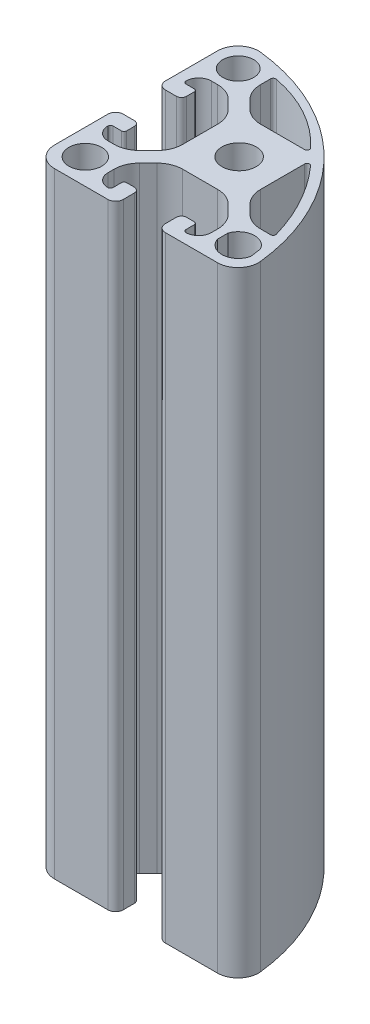
from build123d import *

# Parameters (mm, degrees)
CROQUIS1_R              = 3.35
SALIENTE_EXTRUIR1_DEPTH = 120
SALIENTE_EXTRUIR2_START = -120
SALIENTE_EXTRUIR2_DEPTH = 120


with BuildPart() as part:
    # Croquis1 → Saliente-Extruir1 (new body)
    with BuildSketch(Plane(origin=(0, 0, 0), x_dir=(1, 0, 0), z_dir=(0, 1, 0))):
        with BuildLine():
            Line((4.099999986, -16.349999949), (4.099999986, -18.499999949))
            ThreePointArc((4.099999986, -18.499999949), (4.539339815, -19.560660121), (5.599999987, -19.999999949))
            Line((5.599999987, -19.999999949), (15.777087623, -19.999999949))
            ThreePointArc((15.777087623, -19.999999949), (18.758511608, -18.66666665), (19.752319619, -15.555555546))
            ThreePointArc((19.752319619, -15.555555546), (8.284271243, 8.284271252), (-15.555555578, 19.752319582))
            ThreePointArc((-15.555555578, 19.752319582), (-18.666666685, 18.758511591), (-20.000000016, 15.777087623))
            Line((-20.000000016, 15.777087623), (-20.000000016, 5.599999985))
            ThreePointArc((-20.000000016, 5.599999985), (-19.560660185, 4.539339815), (-18.500000013, 4.099999988))
            Line((-18.500000013, 4.099999988), (-16.350000012, 4.099999988))
            ThreePointArc((-16.350000012, 4.099999988), (-15.642893231, 4.392893207), (-15.350000012, 5.099999988))
            Line((-15.350000012, 5.099999988), (-15.350000012, 6.599999984))
            ThreePointArc((-15.350000012, 6.599999984), (-15.49644662, 6.953553378), (-15.850000012, 7.099999989))
            Line((-15.850000012, 7.099999989), (-17.500000009, 7.099999989))
            ThreePointArc((-17.500000009, 7.099999989), (-17.853553401, 7.246446596), (-18.000000013, 7.599999985))
            ThreePointArc((-18.000000013, 7.599999985), (-17.267766972, 9.36776695), (-15.500000013, 10.100000003))
            Line((-15.500000013, 10.100000003), (-14.292388135, 10.100000003))
            ThreePointArc((-14.292388135, 10.100000003), (-12.378970991, 9.719397659), (-10.756854262, 8.635533909))
            Line((-10.756854262, 8.635533909), (-9.064466108, 6.943145756))
            ThreePointArc((-9.064466108, 6.943145756), (-7.980602349, 5.32102901), (-7.60000001, 3.407611846))
            Line((-7.60000001, 3.407611846), (-7.60000001, -3.407611843))
            ThreePointArc((-7.60000001, -3.407611843), (-7.980602347, -5.321029004), (-9.064466104, -6.943145748))
            Line((-9.064466104, -6.943145748), (-10.756854257, -8.635533901))
            ThreePointArc((-10.756854257, -8.635533901), (-12.378971003, -9.719397661), (-14.292388167, -10.099999999))
            Line((-14.292388167, -10.099999999), (-15.499999985, -10.099999999))
            ThreePointArc((-15.499999985, -10.099999999), (-17.267766956, -9.367766956), (-18.000000007, -7.599999987))
            ThreePointArc((-18.000000007, -7.599999987), (-17.853553397, -7.246446598), (-17.500000007, -7.099999989))
            Line((-17.500000007, -7.099999989), (-15.850000011, -7.099999989))
            ThreePointArc((-15.850000011, -7.099999989), (-15.496446618, -6.953553381), (-15.350000008, -6.599999989))
            Line((-15.350000008, -6.599999989), (-15.350000008, -5.099999989))
            ThreePointArc((-15.350000008, -5.099999989), (-15.642893227, -4.392893209), (-16.350000008, -4.09999999))
            Line((-16.350000008, -4.09999999), (-18.500000008, -4.09999999))
            ThreePointArc((-18.500000008, -4.09999999), (-19.56066018, -4.539339819), (-20.000000008, -5.599999991))
            Line((-20.000000008, -5.599999991), (-20.000000008, -15.999999939))
            ThreePointArc((-20.000000008, -15.999999939), (-18.828427101, -18.828427077), (-15.999999951, -19.999999954))
            Line((-15.999999951, -19.999999954), (-5.599999986, -19.999999954))
            ThreePointArc((-5.599999986, -19.999999954), (-4.539339818, -19.560660123), (-4.099999992, -18.499999954))
            Line((-4.099999992, -18.499999954), (-4.099999992, -16.349999953))
            ThreePointArc((-4.099999992, -16.349999953), (-4.392893211, -15.642893171), (-5.099999992, -15.349999953))
            Line((-5.099999992, -15.349999953), (-6.599999988, -15.349999953))
            ThreePointArc((-6.599999988, -15.349999953), (-6.953553382, -15.49644656), (-7.099999993, -15.849999953))
            Line((-7.099999993, -15.849999953), (-7.099999993, -17.499999952))
            ThreePointArc((-7.099999993, -17.499999952), (-7.2464466, -17.853553342), (-7.599999989, -17.999999954))
            ThreePointArc((-7.599999989, -17.999999954), (-9.367766954, -17.267766913), (-10.100000007, -15.499999954))
            Line((-10.100000007, -15.499999954), (-10.100000007, -14.292388076))
            ThreePointArc((-10.100000007, -14.292388076), (-9.719397663, -12.378970931), (-8.635533913, -10.756854202))
            Line((-8.635533913, -10.756854202), (-6.94314576, -9.064466049))
            ThreePointArc((-6.94314576, -9.064466049), (-5.321029014, -7.980602289), (-3.40761185, -7.599999951))
            Line((-3.40761185, -7.599999951), (3.407611837, -7.599999951))
            ThreePointArc((3.407611837, -7.599999951), (5.321028999, -7.980602288), (6.943145744, -9.064466044))
            Line((6.943145744, -9.064466044), (8.635533897, -10.756854198))
            ThreePointArc((8.635533897, -10.756854198), (9.719397657, -12.378970943), (10.099999995, -14.292388108))
            Line((10.099999995, -14.292388108), (10.099999995, -15.499999937))
            ThreePointArc((10.099999995, -15.499999937), (9.367766948, -17.267766901), (7.599999983, -17.999999948))
            ThreePointArc((7.599999983, -17.999999948), (7.246446594, -17.853553337), (7.099999985, -17.499999948))
            Line((7.099999985, -17.499999948), (7.099999985, -15.849999952))
            ThreePointArc((7.099999985, -15.849999952), (6.953553377, -15.496446559), (6.599999985, -15.349999949))
            Line((6.599999985, -15.349999949), (5.099999986, -15.349999949))
            ThreePointArc((5.099999986, -15.349999949), (4.392893205, -15.642893168), (4.099999986, -16.349999949))
        make_face()
        with Locations(Location((0, 0, 0), (0, 0, 270))):
            Circle(CROQUIS1_R, mode=Mode.SUBTRACT)
        with BuildLine():
            Line((-18.200000016, 12.299999981), (-18.200000016, 15.777087623))
            ThreePointArc((-18.200000016, 15.777087623), (-17.466666684, 17.416870805), (-15.755555575, 17.963465201))
            ThreePointArc((-15.755555575, 17.963465201), (-13.970008189, 17.721071), (-12.197878052, 17.394744174))
            ThreePointArc((-12.197878052, 17.394744174), (-11.91201741, 17.22067196), (-11.800000067, 16.905284013))
            Line((-11.800000067, 16.905284013), (-11.800000067, 12.299999704))
            ThreePointArc((-11.800000067, 12.299999704), (-11.946446503, 11.946446622), (-12.299999521, 11.800000031))
            Line((-12.299999521, 11.800000031), (-17.700000056, 11.800000031))
            ThreePointArc((-17.700000056, 11.800000031), (-18.053553418, 11.946446622), (-18.200000016, 12.299999981))
        make_face(mode=Mode.SUBTRACT)
        with BuildLine():
            Line((11.800000005, -17.699999962), (11.800000005, -12.299999803))
            ThreePointArc((11.800000005, -12.299999803), (11.946446442, -11.946446721), (12.299999459, -11.80000013))
            Line((12.299999459, -11.80000013), (16.905284227, -11.80000013))
            ThreePointArc((16.905284227, -11.80000013), (17.220672032, -11.912017476), (17.394744196, -12.197877993))
            ThreePointArc((17.394744196, -12.197877993), (17.721071033, -13.970008163), (17.963465241, -15.755555583))
            ThreePointArc((17.963465241, -15.755555583), (17.416870817, -17.466666655), (15.777087646, -18.199999948))
            Line((15.777087646, -18.199999948), (12.300000016, -18.199999948))
            ThreePointArc((12.300000016, -18.199999948), (11.946446626, -18.053553344), (11.800000005, -17.699999962))
        make_face(mode=Mode.SUBTRACT)
        with BuildLine():
            Line((-18.200000037, -15.999999938), (-18.200000037, -12.29999998))
            ThreePointArc((-18.200000037, -12.29999998), (-18.053553433, -11.94644659), (-17.70000005, -11.799999969))
            Line((-17.70000005, -11.799999969), (-12.299999814, -11.799999969))
            ThreePointArc((-12.299999814, -11.799999969), (-11.946446646, -11.946446393), (-11.800000043, -12.299999487))
            Line((-11.800000043, -12.299999487), (-11.800000043, -17.700000023))
            ThreePointArc((-11.800000043, -17.700000023), (-11.946446635, -18.053553384), (-12.299999994, -18.199999983))
            Line((-12.299999994, -18.199999983), (-15.999999951, -18.199999983))
            ThreePointArc((-15.999999951, -18.199999983), (-17.555634915, -17.555634891), (-18.200000037, -15.999999938))
        make_face(mode=Mode.SUBTRACT)
        with BuildLine():
            Line((-10.100000018, 14.292388152), (-10.100000018, 16.237135643))
            ThreePointArc((-10.100000018, 16.237135643), (-9.900860854, 16.636488564), (-9.462068989, 16.717734255))
            ThreePointArc((-9.462068989, 16.717734255), (-1.335812596, 13.79371517), (5.466577064, 8.472679041))
            ThreePointArc((5.466577064, 8.472679041), (5.600331365, 7.921589685), (5.133244904, 7.599999995))
            Line((5.133244904, 7.599999995), (-3.407611859, 7.599999995))
            ThreePointArc((-3.407611859, 7.599999995), (-5.321029022, 7.980602332), (-6.943145766, 9.064466088))
            Line((-6.943145766, 9.064466088), (-8.63553392, 10.756854242))
            ThreePointArc((-8.63553392, 10.756854242), (-9.719397679, 12.378970987), (-10.100000018, 14.292388152))
        make_face(mode=Mode.SUBTRACT)
        with BuildLine():
            Line((16.237135661, -10.099999987), (14.292388142, -10.099999987))
            ThreePointArc((14.292388142, -10.099999987), (12.378970987, -9.719397647), (10.75685425, -8.635533892))
            Line((10.75685425, -8.635533892), (9.064466096, -6.943145739))
            ThreePointArc((9.064466096, -6.943145739), (7.980602337, -5.321028994), (7.599999998, -3.407611829))
            Line((7.599999998, -3.407611829), (7.599999998, 5.133244926))
            ThreePointArc((7.599999998, 5.133244926), (7.921589687, 5.600331384), (8.472679039, 5.466577086))
            ThreePointArc((8.472679039, 5.466577086), (13.438953564, -1.531746557), (16.71773428, -9.462068964))
            ThreePointArc((16.71773428, -9.462068964), (16.636488582, -9.900860826), (16.237135661, -10.099999987))
        make_face(mode=Mode.SUBTRACT)
    extrude(amount=SALIENTE_EXTRUIR1_DEPTH)

    # Croquis2 → Saliente-Extruir2 (add)
    with BuildSketch(Plane(origin=(0, 120, 0), x_dir=(1, 0, 0), z_dir=(0, 1, 0)).offset(SALIENTE_EXTRUIR2_START)):
        with BuildLine():
            ThreePointArc((-15.00000005, -11.799999969), (-12.737258345, -12.737258271), (-11.800000043, -14.999999976))
            Line((-11.800000043, -14.999999976), (-11.800000043, -12.299999487))
            ThreePointArc((-11.800000043, -12.299999487), (-11.946446646, -11.946446393), (-12.299999814, -11.799999969))
            Line((-12.299999814, -11.799999969), (-15.00000005, -11.799999969))
        make_face()
        with BuildLine():
            ThreePointArc((-11.800000043, -14.999999976), (-12.737258345, -17.26274168), (-15.00000005, -18.199999983))
            Line((-15.00000005, -18.199999983), (-12.299999994, -18.199999983))
            ThreePointArc((-12.299999994, -18.199999983), (-11.946446635, -18.053553384), (-11.800000043, -17.700000023))
            Line((-11.800000043, -17.700000023), (-11.800000043, -14.999999976))
        make_face()
        with BuildLine():
            ThreePointArc((-18.200000037, -15.999999938), (-17.555634915, -17.555634891), (-15.999999951, -18.199999983))
            Line((-15.999999951, -18.199999983), (-15.00000005, -18.199999983))
            ThreePointArc((-15.00000005, -18.199999983), (-17.262741755, -17.26274168), (-18.200000057, -14.999999976))
            Line((-18.200000037, -14.999999976), (-18.200000037, -15.999999938))
        make_face()
        with BuildLine():
            Line((-18.200000037, -12.29999998), (-18.200000037, -14.999999976))
            ThreePointArc((-18.200000057, -14.999999976), (-17.262741755, -12.737258271), (-15.00000005, -11.799999969))
            Line((-15.00000005, -11.799999969), (-17.70000005, -11.799999969))
            ThreePointArc((-17.70000005, -11.799999969), (-18.053553433, -11.94644659), (-18.200000037, -12.29999998))
        make_face()
        with BuildLine():
            ThreePointArc((-15.755555575, 17.963465201), (-17.466666684, 17.416870805), (-18.200000016, 15.777087623))
            Line((-18.200000016, 15.777087623), (-18.200000016, 12.299999981))
            ThreePointArc((-18.200000016, 12.299999981), (-18.053553418, 11.946446622), (-17.700000056, 11.800000031))
            Line((-17.700000056, 11.800000031), (-14.992840663, 11.800000031))
            ThreePointArc((-14.992840663, 11.800000031), (-18.006058488, 15.03645487), (-14.562863205, 17.811076975))
            ThreePointArc((-14.562863205, 17.811076975), (-15.158609779, 17.891964046), (-15.755555575, 17.963465201))
        make_face()
        with BuildLine():
            ThreePointArc((-12.197878052, 17.394744174), (-13.37709835, 17.621498805), (-14.562863205, 17.811076975))
            ThreePointArc((-14.562863205, 17.811076975), (-12.709765496, 16.799175178), (-11.971923864, 14.82091683))
            ThreePointArc((-11.971923864, 14.82091683), (-12.856729909, 12.684806076), (-14.992840663, 11.800000031))
            Line((-14.992840663, 11.800000031), (-12.299999521, 11.800000031))
            ThreePointArc((-12.299999521, 11.800000031), (-11.946446503, 11.946446622), (-11.800000067, 12.299999704))
            Line((-11.800000067, 12.299999704), (-11.800000067, 16.905284013))
            ThreePointArc((-11.800000067, 16.905284013), (-11.91201741, 17.22067196), (-12.197878052, 17.394744174))
        make_face()
        with BuildLine():
            Line((16.905284227, -11.80000013), (14.828541229, -11.80000013))
            ThreePointArc((14.828541229, -11.80000013), (16.461401303, -12.247952184), (17.637109474, -13.466395191))
            ThreePointArc((17.637109474, -13.466395191), (17.521287961, -12.831112285), (17.394744196, -12.197877993))
            ThreePointArc((17.394744196, -12.197877993), (17.220672032, -11.912017476), (16.905284227, -11.80000013))
        make_face()
        with BuildLine():
            Line((11.800000005, -12.299999803), (11.800000005, -13.966589436))
            ThreePointArc((11.800000005, -13.966589436), (12.966675823, -12.397413513), (14.828541229, -11.80000013))
            Line((14.828541229, -11.80000013), (12.299999459, -11.80000013))
            ThreePointArc((12.299999459, -11.80000013), (11.946446442, -11.946446721), (11.800000005, -12.299999803))
        make_face()
        with BuildLine():
            ThreePointArc((11.800000005, -17.699999962), (11.946446626, -18.053553344), (12.300000016, -18.199999948))
            Line((12.300000016, -18.199999948), (14.828541229, -18.199999948))
            ThreePointArc((14.828541229, -18.199999948), (12.966675823, -17.602586565), (11.800000005, -16.033410642))
            Line((11.800000005, -16.033410642), (11.800000005, -17.699999962))
        make_face()
        with BuildLine():
            ThreePointArc((17.955118446, -15.681552916), (16.835906452, -17.492084364), (14.828541229, -18.199999948))
            Line((14.828541229, -18.199999948), (15.777087646, -18.199999948))
            ThreePointArc((15.777087646, -18.199999948), (17.416870817, -17.466666655), (17.963465241, -15.755555583))
            ThreePointArc((17.963465241, -15.755555583), (17.959309877, -15.718552215), (17.955118446, -15.681552916))
        make_face()
    extrude(amount=SALIENTE_EXTRUIR2_DEPTH)


solid = part.part
